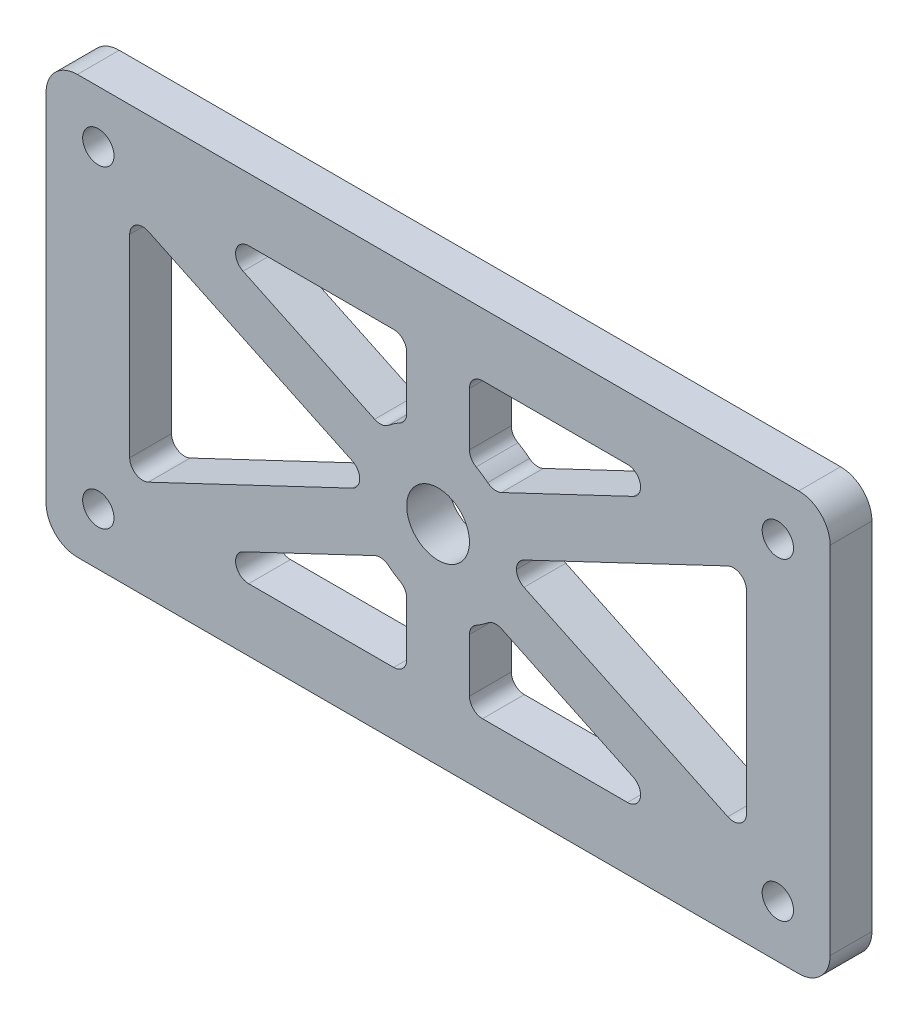
from build123d import *

# Parameters (mm, degrees)
SKETCH_1_W          = 75
SKETCH_1_H          = 40
EXTRUDE_1_DEPTH     = 4
SKETCH_3_R          = 3
CUT_EXTRUDE_1_DEPTH = 4
SKETCH_4_R          = 1.5
CUT_EXTRUDE_2_DEPTH = 10
FILLET_1_R          = 3
CUT_EXTRUDE_3_DEPTH = 10
EXTRUDE_2_DEPTH     = 4
FILLET_2_R          = 1.25


with BuildPart() as part:
    # 草图1 → 凸台-拉伸1 (new body)
    with BuildSketch(Plane.XY):
        Rectangle(SKETCH_1_W, SKETCH_1_H)
    extrude(amount=EXTRUDE_1_DEPTH)

    # 草图3 → 切除-拉伸1 (cut)
    with BuildSketch(Plane.XY.offset(4)):
        Circle(SKETCH_3_R)
    extrude(amount=-CUT_EXTRUDE_1_DEPTH, mode=Mode.SUBTRACT)

    # 草图4 → 切除-拉伸2 (cut)
    with BuildSketch(Plane.XY.offset(4)):
        with Locations((32.5, 15)):
            Circle(SKETCH_4_R)
        with Locations((-32.5, 15)):
            Circle(SKETCH_4_R)
        with Locations((-32.5, -15)):
            Circle(SKETCH_4_R)
        with Locations((32.5, -15)):
            Circle(SKETCH_4_R)
    extrude(amount=-CUT_EXTRUDE_2_DEPTH, mode=Mode.SUBTRACT)

    # 圆角1
    fillet_1_edges = [part.edges().sort_by_distance(p)[0] for p in [
        (37.5, -20, 2),
        (-37.5, -20, 2),
        (-37.5, 20, 2),
        (37.5, 20, 2),
    ]]
    fillet(fillet_1_edges, radius=FILLET_1_R)

    # 草图5 → 切除-拉伸3 (cut)
    with BuildSketch(Plane.XY.offset(4)):
        with BuildLine():
            Line((-29.5, 14), (-3, 14))
            Line((-3, 14), (-3, 6.873863542))
            ThreePointArc((-3, 6.873863542), (-7.5, 0), (-3, -6.873863542))
            Line((-3, -6.873863542), (-3, -14))
            Line((-3, -14), (-29.5, -14))
            Line((-29.5, -14), (-29.5, 14))
        make_face()
    cut_extrude_3 = extrude(amount=-CUT_EXTRUDE_3_DEPTH, mode=Mode.SUBTRACT)

    # 镜向1: 切除-拉伸3 across plane
    add(cut_extrude_3.mirror(Plane(origin=(0, 0, 0), x_dir=(0, 0, 1), z_dir=(1, 0, 0))), mode=Mode.SUBTRACT)

    # 草图6 → 凸台-拉伸2 (add)
    with BuildSketch(Plane.XY.offset(4)):
        with BuildLine():
            Line((-7.460046298, -0.773116571), (-29.5, -11.232755616))
            Line((-29.5, -11.232755616), (-29.5, -14))
            Line((-29.5, -14), (-23.669020762, -14))
            Line((-23.669020762, -14), (-5.316324036, -5.290245622))
            ThreePointArc((-5.316324036, -5.290245622), (-6.775693577, -3.215583392), (-7.460046298, -0.773116571))
        make_face()
        with BuildLine():
            Line((-29.5, 14), (-29.5, 11.232755616))
            Line((-29.5, 11.232755616), (-7.460046298, 0.773116571))
            ThreePointArc((-7.460046298, 0.773116571), (-6.775693577, 3.215583392), (-5.316324036, 5.290245622))
            Line((-5.316324036, 5.290245622), (-23.669020762, 14))
            Line((-23.669020762, 14), (-29.5, 14))
        make_face()
        with BuildLine():
            Line((23.669020762, 14), (5.316324036, 5.290245622))
            ThreePointArc((5.316324036, 5.290245622), (6.775693577, 3.215583392), (7.460046298, 0.773116571))
            Line((7.460046298, 0.773116571), (29.5, 11.232755616))
            Line((29.5, 11.232755616), (29.5, 14))
            Line((29.5, 14), (23.669020762, 14))
        make_face()
        with BuildLine():
            ThreePointArc((7.460046298, -0.773116571), (6.775693577, -3.215583392), (5.316324036, -5.290245622))
            Line((5.316324036, -5.290245622), (23.669020762, -14))
            Line((23.669020762, -14), (29.5, -14))
            Line((29.5, -14), (29.5, -11.232755616))
            Line((29.5, -11.232755616), (7.460046298, -0.773116571))
        make_face()
    extrude(amount=-EXTRUDE_2_DEPTH)

    # 圆角2
    fillet_2_edges = [part.edges().sort_by_distance(p)[0] for p in [
        (3, -14, 2),
        (3, -6.873863542, 2),
        (3, 6.873863542, 2),
        (3, 14, 2),
        (-29.5, -11.232755616, 2),
        (-7.460046298, -0.773116571, 2),
        (-5.316324036, -5.290245622, 2),
        (-23.669020762, -14, 2),
        (-23.669020762, 14, 2),
        (-5.316324036, 5.290245622, 2),
        (-7.460046298, 0.773116571, 2),
        (-29.5, 11.232755616, 2),
        (5.316324036, 5.290245622, 2),
        (23.669020762, 14, 2),
        (29.5, 11.232755616, 2),
        (7.460046298, 0.773116571, 2),
        (7.460046298, -0.773116571, 2),
        (29.5, -11.232755616, 2),
        (23.669020762, -14, 2),
        (5.316324036, -5.290245622, 2),
        (-3, 14, 2),
        (-3, 6.873863542, 2),
        (-3, -6.873863542, 2),
        (-3, -14, 2),
    ]]
    fillet(fillet_2_edges, radius=FILLET_2_R)


solid = part.part
